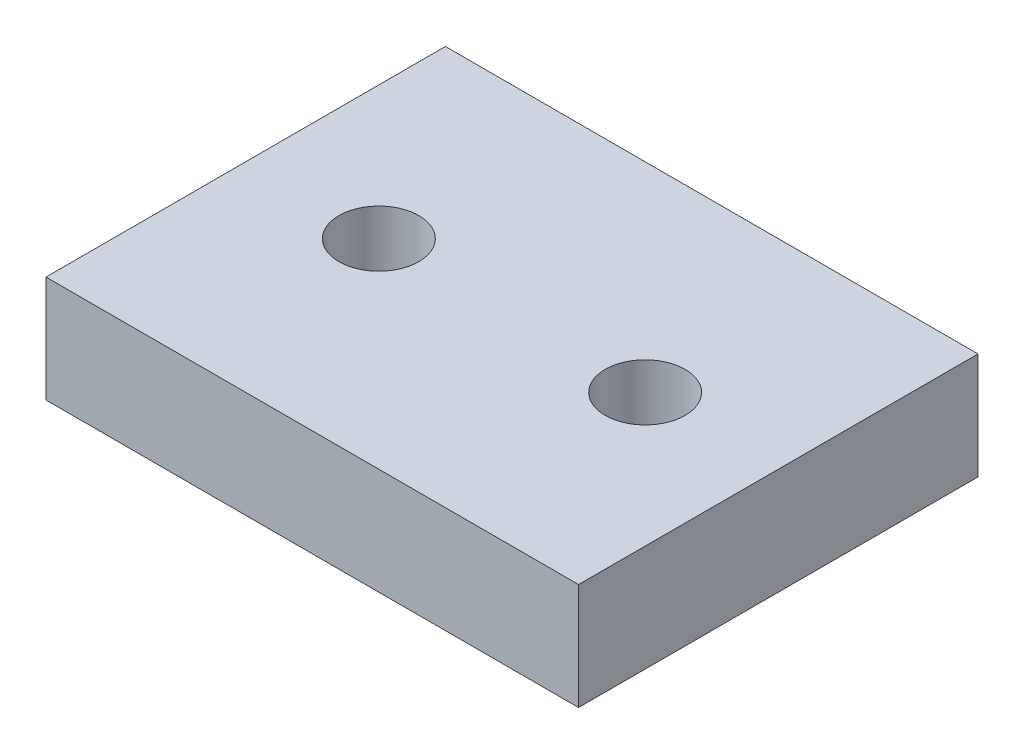
from build123d import *

# Parameters (mm, degrees)
SKETCH2_W                    = 15
SKETCH2_H                    = 4
PROFILEBOSS_EXTRUDE1_DEPTH   = 20
MOUNTHOLESSKETCH5_R          = 1.5
MOUNTHOLESCUT_EXTRUDE2_DEPTH = 26.317977802


with BuildPart() as part:
    # Sketch2 → ProfileBoss-Extrude1 (new body)
    with BuildSketch(Plane(origin=(0, 0, 0), x_dir=(0, 0, -1), z_dir=(1, 0, 0))):
        with Locations((7.5, 2)):
            Rectangle(SKETCH2_W, SKETCH2_H)
    extrude(amount=PROFILEBOSS_EXTRUDE1_DEPTH)

    # MountHolesSketch5 → MountHolesCut-Extrude2 (cut, through all)
    with BuildSketch(Plane(origin=(0, 4, 0), x_dir=(1, 0, 0), z_dir=(0, 1, 0))):
        with Locations(Location((5, 7.5, 0), (0, 0, 270))):
            Circle(MOUNTHOLESSKETCH5_R)
        with Locations(Location((15, 7.5, 0), (0, 0, 270))):
            Circle(MOUNTHOLESSKETCH5_R)
    extrude(amount=-MOUNTHOLESCUT_EXTRUDE2_DEPTH, mode=Mode.SUBTRACT)


solid = part.part
